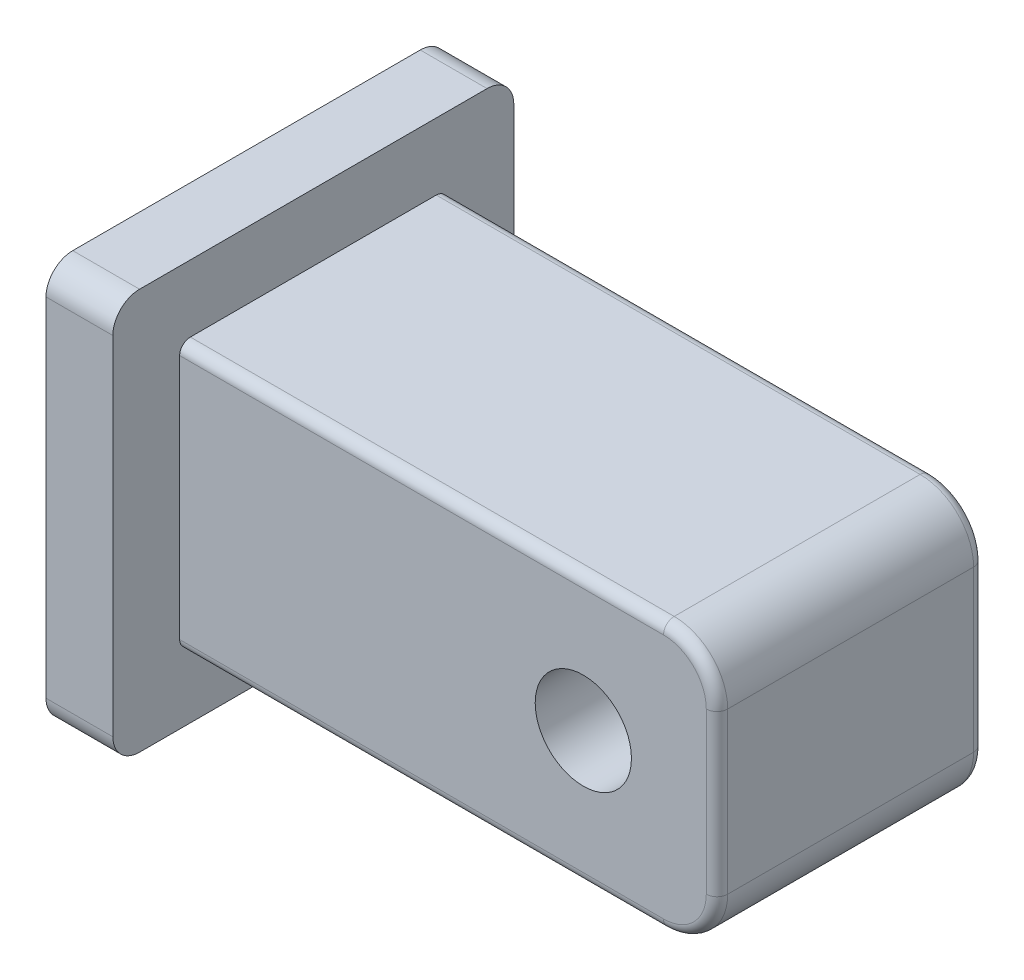
from build123d import *

# Parameters (mm, degrees)
SKETCH2_W               = 28.702
SKETCH2_H               = 12.7
BOSS_EXTRUDE1_DEPTH     = 12.7
CUT_EXTRUDE1_DEPTH      = 34.858304801
CUT_EXTRUDE1_DEPTH_BACK = 34.858304801
SKETCH3_R               = 2.286
FILLET1_R               = 2.54
SKETCH4_W               = 19.05
SKETCH4_H               = 19.05
BOSS_EXTRUDE2_DEPTH     = 3.175
FILLET2_R               = 0.508
FILLET3_R               = 1.27


with BuildPart() as part:
    # Sketch2 → Boss-Extrude1 (new body)
    with BuildSketch(Plane.XY):
        with Locations((-14.351, -6.35)):
            Rectangle(SKETCH2_W, SKETCH2_H)
    extrude(amount=BOSS_EXTRUDE1_DEPTH)

    # Sketch3 → Cut-Extrude1 (cut, two sides: drawn at the far end of the back side and taken through both)
    with BuildSketch(Plane.XY.offset(12.7).offset(-CUT_EXTRUDE1_DEPTH_BACK)):
        with Locations((-6.35, -6.35)):
            Circle(SKETCH3_R)
    extrude(amount=CUT_EXTRUDE1_DEPTH + CUT_EXTRUDE1_DEPTH_BACK, mode=Mode.SUBTRACT)

    # Fillet1
    fillet1_edges = [part.edges().sort_by_distance(p)[0] for p in [
        (0, -12.7, 6.35),
        (0, 0, 6.35),
    ]]
    fillet(fillet1_edges, radius=FILLET1_R)

    # Sketch4 → Boss-Extrude2 (add)
    with BuildSketch(Plane.ZY.offset(28.702)):
        with Locations((6.35, -6.35)):
            Rectangle(SKETCH4_W, SKETCH4_H)
    extrude(amount=-BOSS_EXTRUDE2_DEPTH)

    # Fillet2
    fillet2_edges = [part.edges().sort_by_distance(p)[0] for p in [
        (0, -6.35, 0),
        (0, -6.35, 12.7),
        (-14.0335, 0, 0),
        (-0.743948776, -0.743948776, 0),
        (-0.743948776, -11.956051224, 0),
        (-14.0335, 0, 12.7),
        (-0.743948776, -0.743948776, 12.7),
        (-0.743948776, -11.956051224, 12.7),
        (-14.0335, -12.7, 0),
        (-14.0335, -12.7, 12.7),
    ]]
    fillet(fillet2_edges, radius=FILLET2_R)

    # Fillet3
    fillet3_edges = [part.edges().sort_by_distance(p)[0] for p in [
        (-27.1145, 3.175, 15.875),
        (-27.1145, -15.875, 15.875),
        (-27.1145, -15.875, -3.175),
        (-27.1145, 3.175, -3.175),
    ]]
    fillet(fillet3_edges, radius=FILLET3_R)


solid = part.part
